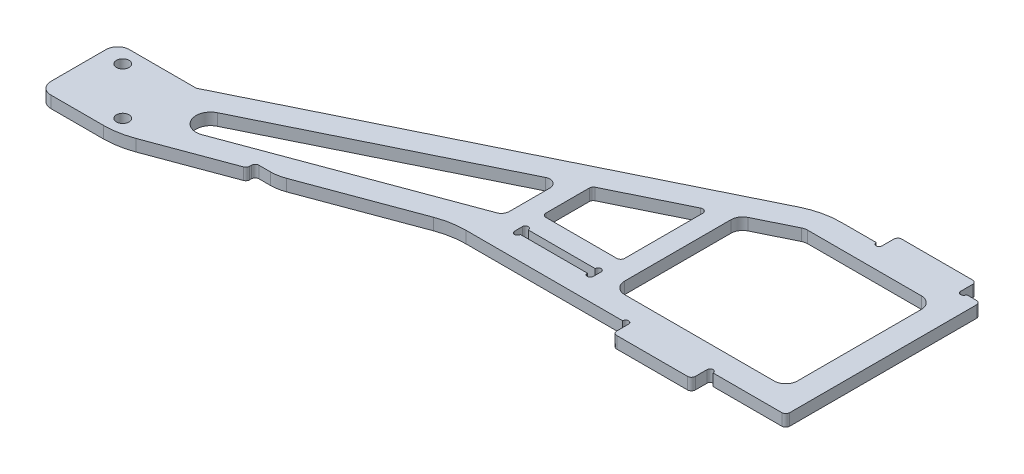
from build123d import *

# Parameters (mm, degrees)
SKETCH_1_R          = 1.6
SKETCH_1_W          = 20
SKETCH_1_H          = 2
EXTRUDE_1_DEPTH     = 3
SKETCH_2_R          = 0.75
CUT_EXTRUDE_1_DEPTH = 157.461656645
FILLET_1_R          = 3
FILLET_2_R          = 20
FILLET_3_R          = 1
FILLET_4_R          = 10


with BuildPart() as part:
    # 草图1 → 凸台-拉伸1 (new body)
    with BuildSketch(Plane(origin=(0, 0, 0), x_dir=(1, 0, 0), z_dir=(0, 1, 0))):
        Polygon((0, 0), (20, 0), (20, 49.5), (15, 49.5), (15, 53.5), (-5, 53.5), (-5, 49.5), (-20, 49.5), (-127, -3), (-147, -3), (-147, -23), (-127, -23), (-103, -14.096774194), (-103, -12), (-97.347826087, -12), (-65, 0), (-20, 0), (-20, -4), (0, -4), align=None)
        with Locations(Location((-141.7, -7, 0), (0, 0, 270))):
            Circle(SKETCH_1_R, mode=Mode.SUBTRACT)
        with Locations(Location((-129.7, -19, 0), (0, 0, 270))):
            Circle(SKETCH_1_R, mode=Mode.SUBTRACT)
        with Locations((-45, 7)):
            Rectangle(SKETCH_1_W, SKETCH_1_H, mode=Mode.SUBTRACT)
    extrude(amount=EXTRUDE_1_DEPTH)

    # 草图2 → 切除-拉伸1 (cut, through all)
    with BuildSketch(Plane(origin=(0, 3, 0), x_dir=(1, 0, 0), z_dir=(0, 1, 0))):
        with Locations((-5.75, 49.5)):
            Circle(SKETCH_2_R)
        with Locations((15.75, 49.5)):
            Circle(SKETCH_2_R)
        with Locations((0.75, 0)):
            Circle(SKETCH_2_R)
        with Locations((-20.75, 0)):
            Circle(SKETCH_2_R)
        with Locations((-54.25, 8)):
            Circle(SKETCH_2_R)
        with Locations((-54.25, 6)):
            Circle(SKETCH_2_R)
        with Locations((-35.75, 6)):
            Circle(SKETCH_2_R)
        with Locations((-35.75, 8)):
            Circle(SKETCH_2_R)
        Polygon((14, 6), (-30, 6), (-30, 37.910143214), (-18.607339503, 43.5), (14, 43.5), align=None)
        Polygon((-35, 35.456872186), (-35, 13), (-55, 13), (-55, 25.643788074), align=None)
        with BuildLine():
            Line((-60, 9.645633867), (-60, 19.981437058))
            ThreePointArc((-60, 19.981437058), (-60.942161442, 21.678781332), (-62.880977584, 21.776953278))
            Line((-62.880977584, 21.776953278), (-118.927003728, -5.722265157))
            ThreePointArc((-118.927003728, -5.722265157), (-120.699269674, -10.510654148), (-116.006358262, -12.522165568))
            Line((-116.006358262, -12.522165568), (-61.304386354, 7.77050143))
            ThreePointArc((-61.304386354, 7.77050143), (-60.358167595, 8.503536518), (-60, 9.645633867))
        make_face()
    extrude(amount=-CUT_EXTRUDE_1_DEPTH, mode=Mode.SUBTRACT)

    # 圆角1
    fillet_1_edges = [part.edges().sort_by_distance(p)[0] for p in [
        (14, 1.5, -43.5),
        (14, 1.5, -6),
        (-30, 1.5, -6),
        (-30, 1.5, -37.910143214),
        (-18.607339503, 1.5, -43.5),
        (-147, 1.5, 23),
        (-147, 1.5, 3),
    ]]
    fillet(fillet_1_edges, radius=FILLET_1_R)

    # 圆角2
    fillet_2_edges = [part.edges().sort_by_distance(p)[0] for p in [
        (-65, 1.5, 0),
        (-127, 1.5, 23),
        (-20, 1.5, -49.5),
    ]]
    fillet(fillet_2_edges, radius=FILLET_2_R)

    # 圆角3
    fillet_3_edges = [part.edges().sort_by_distance(p)[0] for p in [
        (-55, 1.5, -13),
        (-55, 1.5, -25.643788074),
        (-35, 1.5, -35.456872186),
        (-35, 1.5, -13),
        (0, 1.5, 4),
        (-20, 1.5, 4),
        (-103, 1.5, 12),
        (-103, 1.5, 14.096774194),
        (-5, 1.5, -53.5),
        (15, 1.5, -53.5),
        (20, 1.5, -49.5),
        (20, 1.5, 0),
    ]]
    fillet(fillet_3_edges, radius=FILLET_3_R)

    # 圆角4
    fillet_4_edges = [part.edges().sort_by_distance(p)[0] for p in [
        (-97.347826087, 1.5, 12),
    ]]
    fillet(fillet_4_edges, radius=FILLET_4_R)


solid = part.part
